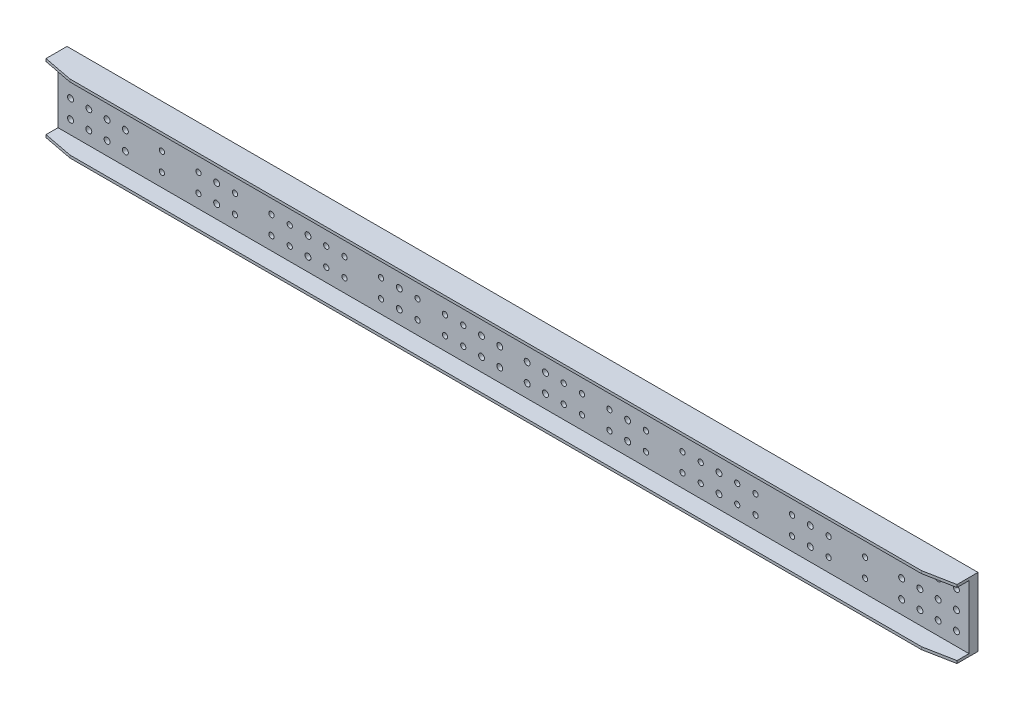
from build123d import *

# Parameters (mm, degrees)
SKETCH_1_W          = 3990
SKETCH_1_H          = 300
SKETCH_1_R          = 13
SKETCH_1_R_2        = 11.5
EXTRUDE_1534_DEPTH  = 39.5
SKETCH_2_W          = 3990
SKETCH_2_H          = 11.5
EXTRUDE_1_DEPTH     = 77.5
SKETCH_3_W          = 70
SKETCH_3_H          = 230
EXTRUDE_2_DEPTH     = 16
SKETCH_4_R          = 13
CUT_EXTRUDE_1_DEPTH = 2003.131676489
CUT_EXTRUDE_2_DEPTH = 2021.820130541


with BuildPart() as part:
    # 草图1 → Extrude 1534 (new body)
    with BuildSketch(Plane.XY):
        Rectangle(SKETCH_1_W, SKETCH_1_H)
        with Locations((1940, 80)):
            Circle(SKETCH_1_R, mode=Mode.SUBTRACT)
        with Locations((1860, 80)):
            Circle(SKETCH_1_R, mode=Mode.SUBTRACT)
        with Locations((1780, 80)):
            Circle(SKETCH_1_R, mode=Mode.SUBTRACT)
        with Locations((1700, 80)):
            Circle(SKETCH_1_R, mode=Mode.SUBTRACT)
        with Locations((1540, 80)):
            Circle(SKETCH_1_R_2, mode=Mode.SUBTRACT)
        with Locations((1380, 80)):
            Circle(SKETCH_1_R_2, mode=Mode.SUBTRACT)
        with Locations((1220, 80)):
            Circle(SKETCH_1_R_2, mode=Mode.SUBTRACT)
        with Locations((1060, 80)):
            Circle(SKETCH_1_R_2, mode=Mode.SUBTRACT)
        with Locations((980, 80)):
            Circle(SKETCH_1_R_2, mode=Mode.SUBTRACT)
        with Locations((820, 80)):
            Circle(SKETCH_1_R_2, mode=Mode.SUBTRACT)
        with Locations((740, 80)):
            Circle(SKETCH_1_R_2, mode=Mode.SUBTRACT)
        with Locations((580, 80)):
            Circle(SKETCH_1_R_2, mode=Mode.SUBTRACT)
        with Locations((980, 0)):
            Circle(SKETCH_1_R_2, mode=Mode.SUBTRACT)
        with Locations((1060, 0)):
            Circle(SKETCH_1_R_2, mode=Mode.SUBTRACT)
        with Locations((820, 0)):
            Circle(SKETCH_1_R_2, mode=Mode.SUBTRACT)
        with Locations((740, 0)):
            Circle(SKETCH_1_R_2, mode=Mode.SUBTRACT)
        with Locations((580, 0)):
            Circle(SKETCH_1_R_2, mode=Mode.SUBTRACT)
        with Locations((1220, 0)):
            Circle(SKETCH_1_R_2, mode=Mode.SUBTRACT)
        with Locations((1380, 0)):
            Circle(SKETCH_1_R_2, mode=Mode.SUBTRACT)
        with Locations((1540, 0)):
            Circle(SKETCH_1_R_2, mode=Mode.SUBTRACT)
        with Locations((1700, 0)):
            Circle(SKETCH_1_R, mode=Mode.SUBTRACT)
        with Locations((1780, 0)):
            Circle(SKETCH_1_R, mode=Mode.SUBTRACT)
        with Locations((1860, 0)):
            Circle(SKETCH_1_R, mode=Mode.SUBTRACT)
        with Locations((1940, 0)):
            Circle(SKETCH_1_R, mode=Mode.SUBTRACT)
        with Locations((420, 80)):
            Circle(SKETCH_1_R_2, mode=Mode.SUBTRACT)
        with Locations((420, 0)):
            Circle(SKETCH_1_R_2, mode=Mode.SUBTRACT)
        with Locations((300, 0)):
            Circle(SKETCH_1_R_2, mode=Mode.SUBTRACT)
        with Locations((300, 80)):
            Circle(SKETCH_1_R_2, mode=Mode.SUBTRACT)
        with Locations((220, 80)):
            Circle(SKETCH_1_R_2, mode=Mode.SUBTRACT)
        with Locations((220, 0)):
            Circle(SKETCH_1_R_2, mode=Mode.SUBTRACT)
        with Locations((140, 0)):
            Circle(SKETCH_1_R, mode=Mode.SUBTRACT)
        with Locations((140, 80)):
            Circle(SKETCH_1_R, mode=Mode.SUBTRACT)
        with Locations((60, 80)):
            Circle(SKETCH_1_R, mode=Mode.SUBTRACT)
        with Locations((60, 0)):
            Circle(SKETCH_1_R, mode=Mode.SUBTRACT)
        with Locations(Location((1700, -80, 0), (0, 0, 180))):
            Circle(SKETCH_1_R, mode=Mode.SUBTRACT)
        with Locations(Location((1780, -80, 0), (0, 0, 180))):
            Circle(SKETCH_1_R, mode=Mode.SUBTRACT)
        with Locations(Location((1860, -80, 0), (0, 0, 180))):
            Circle(SKETCH_1_R, mode=Mode.SUBTRACT)
        with Locations(Location((1940, -80, 0), (0, 0, 180))):
            Circle(SKETCH_1_R, mode=Mode.SUBTRACT)
        with Locations(Location((580, -80, 0), (0, 0, 180))):
            Circle(SKETCH_1_R_2, mode=Mode.SUBTRACT)
        with Locations(Location((740, -80, 0), (0, 0, 180))):
            Circle(SKETCH_1_R_2, mode=Mode.SUBTRACT)
        with Locations(Location((820, -80, 0), (0, 0, 180))):
            Circle(SKETCH_1_R_2, mode=Mode.SUBTRACT)
        with Locations(Location((980, -80, 0), (0, 0, 180))):
            Circle(SKETCH_1_R_2, mode=Mode.SUBTRACT)
        with Locations(Location((1060, -80, 0), (0, 0, 180))):
            Circle(SKETCH_1_R_2, mode=Mode.SUBTRACT)
        with Locations(Location((1220, -80, 0), (0, 0, 180))):
            Circle(SKETCH_1_R_2, mode=Mode.SUBTRACT)
        with Locations(Location((1380, -80, 0), (0, 0, 180))):
            Circle(SKETCH_1_R_2, mode=Mode.SUBTRACT)
        with Locations(Location((1540, -80, 0), (0, 0, 180))):
            Circle(SKETCH_1_R_2, mode=Mode.SUBTRACT)
        with Locations(Location((220, -80, 0), (0, 0, 180))):
            Circle(SKETCH_1_R_2, mode=Mode.SUBTRACT)
        with Locations(Location((300, -80, 0), (0, 0, 180))):
            Circle(SKETCH_1_R_2, mode=Mode.SUBTRACT)
        with Locations(Location((420, -80, 0), (0, 0, 180))):
            Circle(SKETCH_1_R_2, mode=Mode.SUBTRACT)
        with Locations(Location((60, -80, 0), (0, 0, 180))):
            Circle(SKETCH_1_R, mode=Mode.SUBTRACT)
        with Locations(Location((140, -80, 0), (0, 0, 180))):
            Circle(SKETCH_1_R, mode=Mode.SUBTRACT)
        with Locations((-140, -80)):
            Circle(SKETCH_1_R, mode=Mode.SUBTRACT)
        with Locations((-60, -80)):
            Circle(SKETCH_1_R, mode=Mode.SUBTRACT)
        with Locations((-580, -80)):
            Circle(SKETCH_1_R_2, mode=Mode.SUBTRACT)
        with Locations((-420, -80)):
            Circle(SKETCH_1_R_2, mode=Mode.SUBTRACT)
        with Locations((-300, -80)):
            Circle(SKETCH_1_R_2, mode=Mode.SUBTRACT)
        with Locations((-220, -80)):
            Circle(SKETCH_1_R_2, mode=Mode.SUBTRACT)
        with Locations((-1540, -80)):
            Circle(SKETCH_1_R_2, mode=Mode.SUBTRACT)
        with Locations((-1380, -80)):
            Circle(SKETCH_1_R_2, mode=Mode.SUBTRACT)
        with Locations((-1220, -80)):
            Circle(SKETCH_1_R_2, mode=Mode.SUBTRACT)
        with Locations((-1060, -80)):
            Circle(SKETCH_1_R_2, mode=Mode.SUBTRACT)
        with Locations((-980, -80)):
            Circle(SKETCH_1_R_2, mode=Mode.SUBTRACT)
        with Locations((-820, -80)):
            Circle(SKETCH_1_R_2, mode=Mode.SUBTRACT)
        with Locations((-740, -80)):
            Circle(SKETCH_1_R_2, mode=Mode.SUBTRACT)
        with Locations((-1940, -80)):
            Circle(SKETCH_1_R, mode=Mode.SUBTRACT)
        with Locations((-1860, -80)):
            Circle(SKETCH_1_R, mode=Mode.SUBTRACT)
        with Locations((-1780, -80)):
            Circle(SKETCH_1_R, mode=Mode.SUBTRACT)
        with Locations((-1700, -80)):
            Circle(SKETCH_1_R, mode=Mode.SUBTRACT)
        with Locations(Location((-60, 0, 0), (0, 0, 180))):
            Circle(SKETCH_1_R, mode=Mode.SUBTRACT)
        with Locations(Location((-60, 80, 0), (0, 0, 180))):
            Circle(SKETCH_1_R, mode=Mode.SUBTRACT)
        with Locations(Location((-140, 80, 0), (0, 0, 180))):
            Circle(SKETCH_1_R, mode=Mode.SUBTRACT)
        with Locations(Location((-140, 0, 0), (0, 0, 180))):
            Circle(SKETCH_1_R, mode=Mode.SUBTRACT)
        with Locations(Location((-220, 0, 0), (0, 0, 180))):
            Circle(SKETCH_1_R_2, mode=Mode.SUBTRACT)
        with Locations(Location((-220, 80, 0), (0, 0, 180))):
            Circle(SKETCH_1_R_2, mode=Mode.SUBTRACT)
        with Locations(Location((-300, 80, 0), (0, 0, 180))):
            Circle(SKETCH_1_R_2, mode=Mode.SUBTRACT)
        with Locations(Location((-300, 0, 0), (0, 0, 180))):
            Circle(SKETCH_1_R_2, mode=Mode.SUBTRACT)
        with Locations(Location((-420, 0, 0), (0, 0, 180))):
            Circle(SKETCH_1_R_2, mode=Mode.SUBTRACT)
        with Locations(Location((-420, 80, 0), (0, 0, 180))):
            Circle(SKETCH_1_R_2, mode=Mode.SUBTRACT)
        with Locations(Location((-1940, 0, 0), (0, 0, 180))):
            Circle(SKETCH_1_R, mode=Mode.SUBTRACT)
        with Locations(Location((-1860, 0, 0), (0, 0, 180))):
            Circle(SKETCH_1_R, mode=Mode.SUBTRACT)
        with Locations(Location((-1780, 0, 0), (0, 0, 180))):
            Circle(SKETCH_1_R, mode=Mode.SUBTRACT)
        with Locations(Location((-1700, 0, 0), (0, 0, 180))):
            Circle(SKETCH_1_R, mode=Mode.SUBTRACT)
        with Locations(Location((-1540, 0, 0), (0, 0, 180))):
            Circle(SKETCH_1_R_2, mode=Mode.SUBTRACT)
        with Locations(Location((-1380, 0, 0), (0, 0, 180))):
            Circle(SKETCH_1_R_2, mode=Mode.SUBTRACT)
        with Locations(Location((-1220, 0, 0), (0, 0, 180))):
            Circle(SKETCH_1_R_2, mode=Mode.SUBTRACT)
        with Locations(Location((-580, 0, 0), (0, 0, 180))):
            Circle(SKETCH_1_R_2, mode=Mode.SUBTRACT)
        with Locations(Location((-740, 0, 0), (0, 0, 180))):
            Circle(SKETCH_1_R_2, mode=Mode.SUBTRACT)
        with Locations(Location((-820, 0, 0), (0, 0, 180))):
            Circle(SKETCH_1_R_2, mode=Mode.SUBTRACT)
        with Locations(Location((-1060, 0, 0), (0, 0, 180))):
            Circle(SKETCH_1_R_2, mode=Mode.SUBTRACT)
        with Locations(Location((-980, 0, 0), (0, 0, 180))):
            Circle(SKETCH_1_R_2, mode=Mode.SUBTRACT)
        with Locations(Location((-580, 80, 0), (0, 0, 180))):
            Circle(SKETCH_1_R_2, mode=Mode.SUBTRACT)
        with Locations(Location((-740, 80, 0), (0, 0, 180))):
            Circle(SKETCH_1_R_2, mode=Mode.SUBTRACT)
        with Locations(Location((-820, 80, 0), (0, 0, 180))):
            Circle(SKETCH_1_R_2, mode=Mode.SUBTRACT)
        with Locations(Location((-980, 80, 0), (0, 0, 180))):
            Circle(SKETCH_1_R_2, mode=Mode.SUBTRACT)
        with Locations(Location((-1060, 80, 0), (0, 0, 180))):
            Circle(SKETCH_1_R_2, mode=Mode.SUBTRACT)
        with Locations(Location((-1220, 80, 0), (0, 0, 180))):
            Circle(SKETCH_1_R_2, mode=Mode.SUBTRACT)
        with Locations(Location((-1380, 80, 0), (0, 0, 180))):
            Circle(SKETCH_1_R_2, mode=Mode.SUBTRACT)
        with Locations(Location((-1540, 80, 0), (0, 0, 180))):
            Circle(SKETCH_1_R_2, mode=Mode.SUBTRACT)
        with Locations(Location((-1700, 80, 0), (0, 0, 180))):
            Circle(SKETCH_1_R, mode=Mode.SUBTRACT)
        with Locations(Location((-1780, 80, 0), (0, 0, 180))):
            Circle(SKETCH_1_R, mode=Mode.SUBTRACT)
        with Locations(Location((-1860, 80, 0), (0, 0, 180))):
            Circle(SKETCH_1_R, mode=Mode.SUBTRACT)
        with Locations(Location((-1940, 80, 0), (0, 0, 180))):
            Circle(SKETCH_1_R, mode=Mode.SUBTRACT)
    extrude(amount=EXTRUDE_1534_DEPTH)

    # 草图2 → 凸台-拉伸1 (add)
    with BuildSketch(Plane.XY.offset(39.5)):
        with Locations((0, 144.25)):
            Rectangle(SKETCH_2_W, SKETCH_2_H)
        with Locations((0, -144.25)):
            Rectangle(SKETCH_2_W, SKETCH_2_H)
    extrude(amount=EXTRUDE_1_DEPTH)

    # 草图3 → 凸台-拉伸2 (add)
    with BuildSketch(Plane(origin=(0, 0, 0), x_dir=(-1, 0, 0), z_dir=(0, 0, -1))):
        with Locations((1300, 0)):
            Rectangle(SKETCH_3_W, SKETCH_3_H)
        with Locations((900, 0)):
            Rectangle(SKETCH_3_W, SKETCH_3_H)
        with Locations((-1300, 0)):
            Rectangle(SKETCH_3_W, SKETCH_3_H)
        with Locations((500, 0)):
            Rectangle(SKETCH_3_W, SKETCH_3_H)
        with Locations((-900, 0)):
            Rectangle(SKETCH_3_W, SKETCH_3_H)
        with Locations((-500, 0)):
            Rectangle(SKETCH_3_W, SKETCH_3_H)
    extrude(amount=EXTRUDE_2_DEPTH)

    # 草图4 → 切除-拉伸1 (cut, through all)
    with BuildSketch(Plane.XY.offset(39.5)):
        with Locations((1300, 80)):
            Circle(SKETCH_4_R)
        with Locations((900, 80)):
            Circle(SKETCH_4_R)
        with Locations((900, 0)):
            Circle(SKETCH_4_R)
        with Locations((1300, 0)):
            Circle(SKETCH_4_R)
        with Locations(Location((900, -80, 0), (0, 0, 180))):
            Circle(SKETCH_4_R)
        with Locations(Location((1300, -80, 0), (0, 0, 180))):
            Circle(SKETCH_4_R)
        with Locations((500, 80)):
            Circle(SKETCH_4_R)
        with Locations((500, 0)):
            Circle(SKETCH_4_R)
        with Locations(Location((500, -80, 0), (0, 0, 180))):
            Circle(SKETCH_4_R)
        with Locations((-500, -80)):
            Circle(SKETCH_4_R)
        with Locations(Location((-500, 0, 0), (0, 0, 180))):
            Circle(SKETCH_4_R)
        with Locations(Location((-500, 80, 0), (0, 0, 180))):
            Circle(SKETCH_4_R)
        with Locations((-1300, -80)):
            Circle(SKETCH_4_R)
        with Locations((-900, -80)):
            Circle(SKETCH_4_R)
        with Locations(Location((-1300, 0, 0), (0, 0, 180))):
            Circle(SKETCH_4_R)
        with Locations(Location((-900, 0, 0), (0, 0, 180))):
            Circle(SKETCH_4_R)
        with Locations(Location((-900, 80, 0), (0, 0, 180))):
            Circle(SKETCH_4_R)
        with Locations(Location((-1300, 80, 0), (0, 0, 180))):
            Circle(SKETCH_4_R)
    extrude(amount=-CUT_EXTRUDE_1_DEPTH, mode=Mode.SUBTRACT)

    # 草图5 → 切除-拉伸2 (cut, through all)
    with BuildSketch(Plane(origin=(0, 150, 0), x_dir=(-1, 0, 0), z_dir=(0, 1, 0))):
        Polygon((-1995, 92), (-1995, 117), (-1865, 117), align=None)
        Polygon((1865, 117), (1995, 92), (1995, 117), align=None)
    extrude(amount=-CUT_EXTRUDE_2_DEPTH, mode=Mode.SUBTRACT)


solid = part.part
